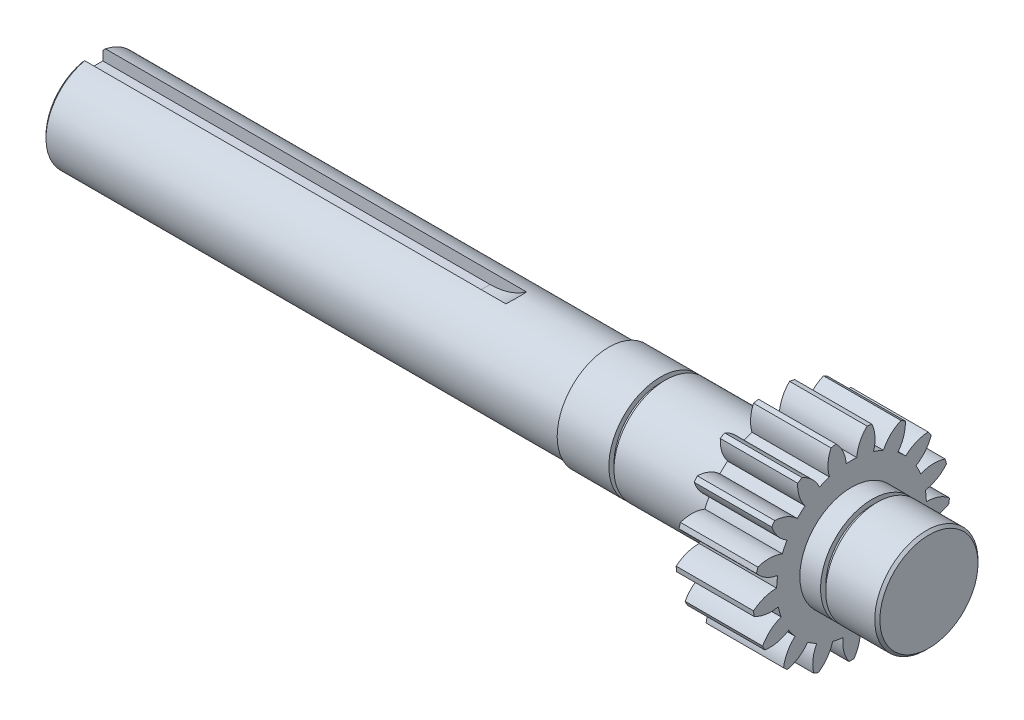
from build123d import *

# Parameters (mm, degrees)
BASPROSKE_W         = 15
BASPROSKE_H         = 19
TOOTHCUT_DEPTH      = 31.773365107
TEETHCUTS_COUNT     = 17
TEETHCUTS_ANGLE     = 338.823529412
BORSKE_R            = 0.4
BORE_DEPTH          = 50.0000508
SKETCH1_R           = 10
BOSS_EXTRUDE1_DEPTH = 15
BOSS_EXTRUDE2_START = 32
SKETCH2_R           = 10
BOSS_EXTRUDE2_DEPTH = 32
BOSS_EXTRUDE3_START = 32
SKETCH2_3_R         = 9.5
BOSS_EXTRUDE3_DEPTH = 100
CUT_EXTRUDE1_DEPTH  = 2
SKETCH4_W           = 1
SKETCH4_H           = 1
CHAMFER1_SIZE       = 0.5


with BuildPart() as part:
    # BasProSke → Base-Revolve (revolve)
    with BuildSketch(Plane(origin=(0, 0, 0), x_dir=(1, 0, 0), z_dir=(0, 1, 0)), mode=Mode.PRIVATE) as base_revolve_sk:
        with Locations((7.5, 9.5)):
            Rectangle(BASPROSKE_W, BASPROSKE_H)
    revolve(base_revolve_sk.sketch.rotate(Axis((-10, 0, 0), (1, 0, 0)), 180), axis=Axis((-10, 0, 0), (1, 0, 0)))

    # TooCutSke → ToothCut (cut, through all)
    with BuildSketch(Plane(origin=(0, 0, 0), x_dir=(0, 0, -1), z_dir=(1, 0, 0))):
        with BuildLine():
            ThreePointArc((1.020352389, 14.463052306), (0, 14.499), (-1.020352389, 14.463052306))
            ThreePointArc((-1.020352389, 14.463052306), (-1.632621885, 16.804485203), (-3.026143023, 18.783192049))
            ThreePointArc((-3.026143023, 18.783192049), (0, 19.0254), (3.026143023, 18.783192049))
            ThreePointArc((3.026143023, 18.783192049), (1.632621885, 16.804485203), (1.020352389, 14.463052306))
        make_face()
    toothcut = extrude(amount=TOOTHCUT_DEPTH, mode=Mode.SUBTRACT)

    # TeethCuts: ToothCut ×17 about axis
    teethcuts_axis = Axis((-10, 0, 0), (1, 0, 0))
    for i in range(1, TEETHCUTS_COUNT):
        add(toothcut.rotate(teethcuts_axis, i * TEETHCUTS_ANGLE / (TEETHCUTS_COUNT - 1)), mode=Mode.SUBTRACT)

    # BorSke → Bore (cut, symmetric)
    with BuildSketch(Plane(origin=(0, 0, 0), x_dir=(0, 0, -1), z_dir=(1, 0, 0))):
        with Locations(Location((0, 0, 0), (0, 0, 180))):
            Circle(BORSKE_R)
    extrude(amount=BORE_DEPTH, both=True, mode=Mode.SUBTRACT)

    # Sketch1 → Boss-Extrude1 (add)
    with BuildSketch(Plane(origin=(15, 0, 0), x_dir=(0, 0, -1), z_dir=(1, 0, 0))):
        with Locations(Location((0, 0, 0), (0, 0, 180))):
            Circle(SKETCH1_R)
    extrude(amount=BOSS_EXTRUDE1_DEPTH)

    # Sketch2 → Boss-Extrude2 (add)
    with BuildSketch(Plane.ZY.offset(BOSS_EXTRUDE2_START)):
        Circle(SKETCH2_R)
    extrude(amount=-BOSS_EXTRUDE2_DEPTH)

    # Sketch2<3> → Boss-Extrude3 (add)
    with BuildSketch(Plane.ZY.offset(BOSS_EXTRUDE3_START)):
        Circle(SKETCH2_3_R)
    extrude(amount=BOSS_EXTRUDE3_DEPTH)

    # Sketch3 → Cut-Extrude1 (cut, symmetric)
    with BuildSketch(Plane.XY):
        with BuildLine():
            Line((-132, 9.5), (-132, 7))
            Line((-132, 7), (-57, 7))
            ThreePointArc((-57, 7), (-53.127016654, 7.642183308), (-49.668560851, 9.5))
            Line((-49.668560851, 9.5), (-132, 9.5))
        make_face()
    extrude(amount=CUT_EXTRUDE1_DEPTH, both=True, mode=Mode.SUBTRACT)

    # Sketch4 → Cut-Revolve1 (revolve, cut)
    with BuildSketch(Plane.XY, mode=Mode.PRIVATE) as cut_revolve1_sk:
        with Locations((19.5, 9.5)):
            Rectangle(SKETCH4_W, SKETCH4_H)
        with Locations((-21.5, 9.5)):
            Rectangle(SKETCH4_W, SKETCH4_H)
    revolve(cut_revolve1_sk.sketch.rotate(Axis((0, 0, 0), (-1, 0, 0)), 90), axis=Axis((0, 0, 0), (-1, 0, 0)), mode=Mode.SUBTRACT)

    # Chamfer1
    chamfer1_edges = [part.edges().sort_by_distance(p)[0] for p in [
        (30, 0, -10),
        (-132, -7.39087275, -5.968668193),
    ]]
    chamfer(chamfer1_edges, length=CHAMFER1_SIZE)


solid = part.part
